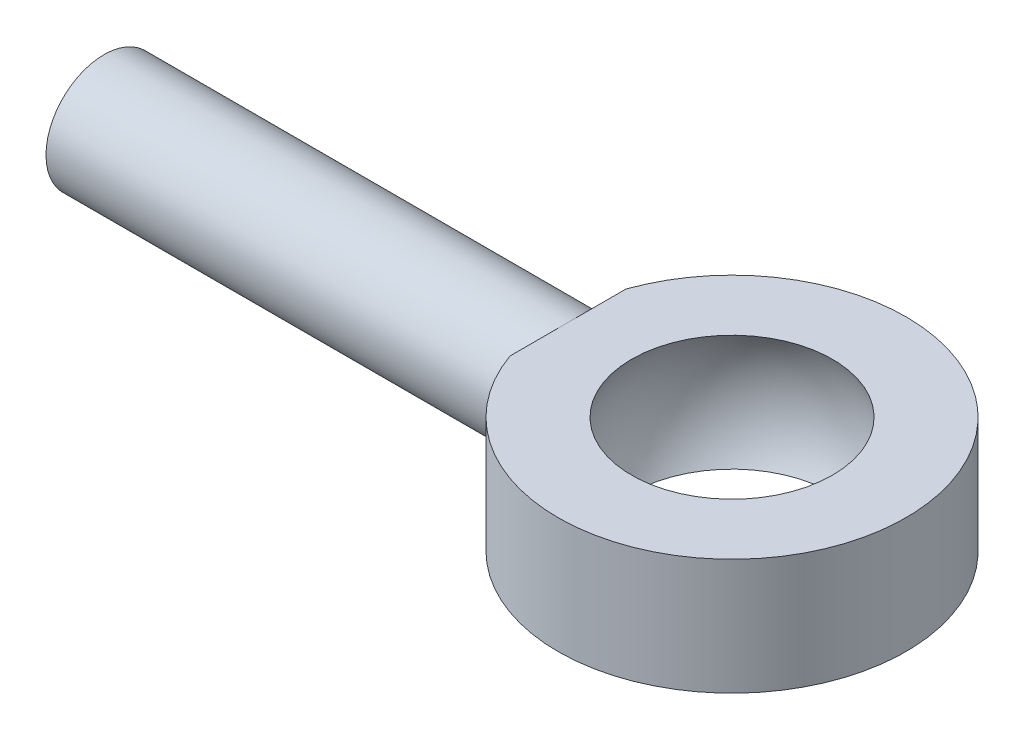
from build123d import *

# Parameters (mm, degrees)
BOSS_EXTRUDE1_DEPTH = 6.35
SKETCH2_R           = 3.175
BOSS_EXTRUDE2_DEPTH = 25.4


with BuildPart() as part:
    # Sketch1 → Boss-Extrude1 (new body)
    with BuildSketch(Plane(origin=(0, 0, 0), x_dir=(1, 0, 0), z_dir=(0, 1, 0))):
        with BuildLine():
            Line((-8.980256121, 3.175), (-8.980256121, -3.175))
            ThreePointArc((-8.980256121, -3.175), (9.525, 0), (-8.980256121, 3.175))
        make_face()
    extrude(amount=BOSS_EXTRUDE1_DEPTH)

    # Sketch2 → Boss-Extrude2 (add)
    with BuildSketch(Plane.ZY.offset(8.980256121)):
        with Locations((0, 3.175)):
            Circle(SKETCH2_R)
    extrude(amount=BOSS_EXTRUDE2_DEPTH)

    # Sketch3 → Cut-Revolve1 (revolve, cut)
    with BuildSketch(Plane.XY):
        with BuildLine():
            Line((0, 9.525), (0, -3.175))
            ThreePointArc((0, -3.175), (6.35, 3.175), (0, 9.525))
        make_face()
    revolve(axis=Axis((0, 6.35, 0), (0, -1, 0)), mode=Mode.SUBTRACT)


solid = part.part
